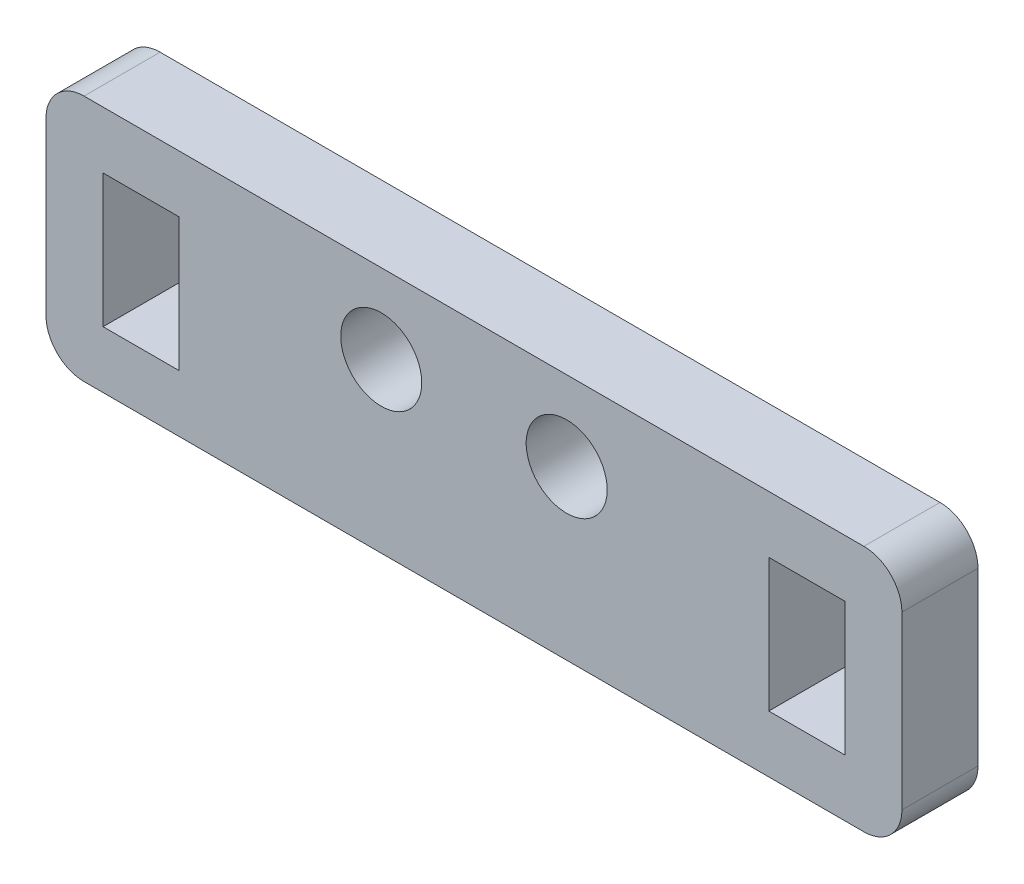
from build123d import *

# Parameters (mm, degrees)
ESQUISSE1_W        = 45
ESQUISSE1_H        = 13
ESQUISSE1_R        = 2.13
ESQUISSE1_W_2      = 4
ESQUISSE1_H_2      = 7
BOSS_EXTRU_1_DEPTH = 4
CONG_1_R           = 2


with BuildPart() as part:
    # Esquisse1 → Boss.-Extru.1 (new body)
    with BuildSketch(Plane.XY):
        Rectangle(ESQUISSE1_W, ESQUISSE1_H)
        with Locations((-4.875, 2.32)):
            Circle(ESQUISSE1_R, mode=Mode.SUBTRACT)
        with Locations((4.875, 2.32)):
            Circle(ESQUISSE1_R, mode=Mode.SUBTRACT)
        with Locations((-17.5, 0)):
            Rectangle(ESQUISSE1_W_2, ESQUISSE1_H_2, mode=Mode.SUBTRACT)
        with Locations((17.5, 0)):
            Rectangle(ESQUISSE1_W_2, ESQUISSE1_H_2, mode=Mode.SUBTRACT)
    extrude(amount=BOSS_EXTRU_1_DEPTH)

    # Congé1
    cong_1_edges = [part.edges().sort_by_distance(p)[0] for p in [
        (-22.5, 6.5, 2),
        (22.5, 6.5, 2),
        (22.5, -6.5, 2),
        (-22.5, -6.5, 2),
    ]]
    fillet(cong_1_edges, radius=CONG_1_R)


solid = part.part
